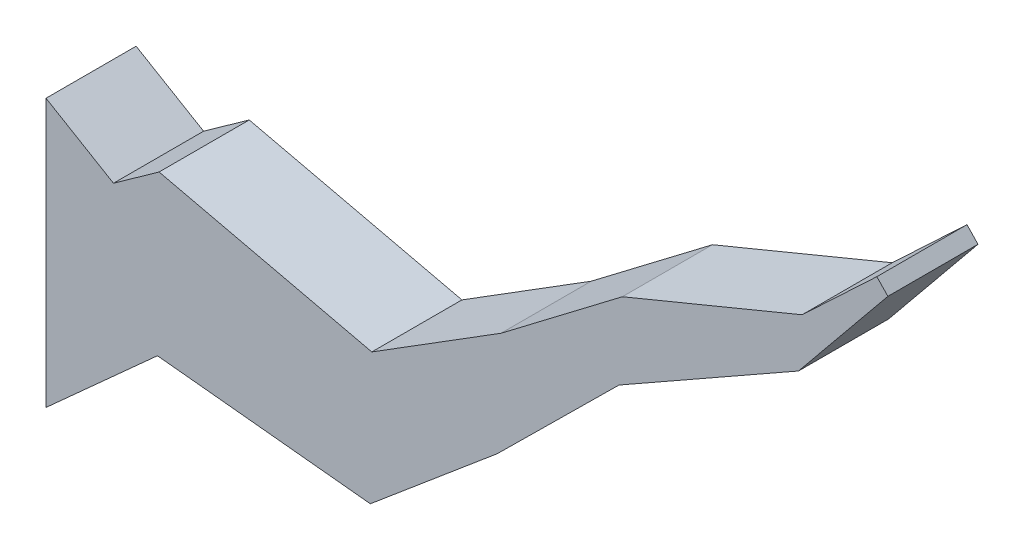
from build123d import *

# Parameters (mm, degrees)
AUFSATZ_LINEAR_AUSTRAGEN1_DEPTH = 3


with BuildPart() as part:
    # Model → Aufsatz-Linear austragen1 (new body)
    with BuildSketch(Plane.XY):
        Polygon((27.757201613, 17.823879819), (25.269410576, 15.48201919), (19.285403887, 13.008865595), (15.246732761, 9.937624528), (10.945087096, 7.248053638), (3.864948468, 8.895369168), (2.346139264, 7.811699181), (0.1, 9.139176818), (0.1, 0.224829603), (3.809633928, 3.57004156), (10.895315766, 2.844989185), (15.122386477, 6.402986505), (19.174325502, 10.407995412), (25.148627395, 13.799695492), (28.124071775, 17.440721322), align=None)
    extrude(amount=AUFSATZ_LINEAR_AUSTRAGEN1_DEPTH)


solid = part.part
